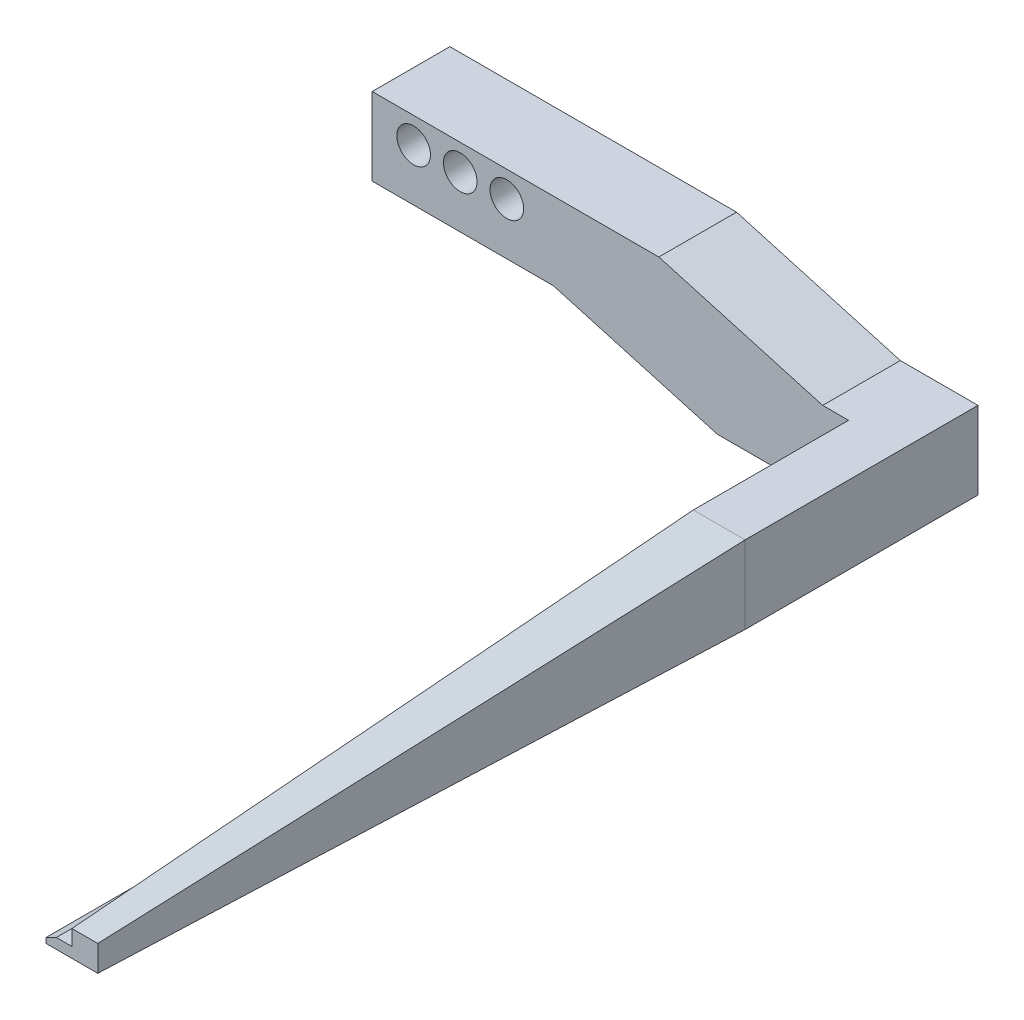
from build123d import *

# Parameters (mm, degrees)
AUFSATZ_LINEAR_AUSTRAGEN1_DEPTH = 15
AUFSATZ_LINEAR_AUSTRAGEN2_DEPTH = 150
SCHNITT_LINEAR_AUSTRAGEN1_REACH = 192.434
SCHNITT_LINEAR_AUSTRAGEN2_REACH = 190.733
SKIZZE4_R                       = 1.7
SKIZZE5_R                       = 3.25
SCHNITT_LINEAR_AUSTRAGEN3_DEPTH = 9
SCHNITT_LINEAR_AUSTRAGEN4_REACH = 201.985


with BuildPart() as part:
    # Skizze1 → Aufsatz-Linear austragen1 (new body)
    with BuildSketch(Plane.XY):
        Polygon((10, 0), (65.364729758, 0), (97, -9), (112, -9), (112, -24), (76.635270242, -24), (45, -15), (10, -15), align=None)
    extrude(amount=AUFSATZ_LINEAR_AUSTRAGEN1_DEPTH)

    # Skizze2 → Aufsatz-Linear austragen2 (add)
    with BuildSketch(Plane.XY.offset(15)):
        Polygon((112, -9), (112, -24), (97, -24), (97, -23), (99, -22), (102, -22), (102, -9), align=None)
    extrude(amount=AUFSATZ_LINEAR_AUSTRAGEN2_DEPTH)

    # Skizze3 → Schnitt-Linear austragen1 (cut, up to next)
    with BuildSketch(Plane.ZY.offset(-102), mode=Mode.PRIVATE) as schnitt_linear_austragen1_sk1:
        Polygon((165, -19), (45, -9), (165, -9), align=None)
    schnitt_linear_austragen1_tool1 = extrude(schnitt_linear_austragen1_sk1.sketch, amount=-SCHNITT_LINEAR_AUSTRAGEN1_REACH, mode=Mode.PRIVATE) & part.part
    add(schnitt_linear_austragen1_tool1.solids().sort_by_distance((102, -12.333333, 125))[0], mode=Mode.SUBTRACT)

    # Skizze4 → Schnitt-Linear austragen2 (cut, up to next)
    with BuildSketch(Plane.XY.offset(15), mode=Mode.PRIVATE) as schnitt_linear_austragen2_sk1:
        with Locations((36, -5)):
            Circle(SKIZZE4_R)
    schnitt_linear_austragen2_tool1 = extrude(schnitt_linear_austragen2_sk1.sketch, amount=-SCHNITT_LINEAR_AUSTRAGEN2_REACH, mode=Mode.PRIVATE) & part.part
    # Skizze4 → Schnitt-Linear austragen2 (cut, up to next)
    with BuildSketch(Plane.XY.offset(15), mode=Mode.PRIVATE) as schnitt_linear_austragen2_sk2:
        with Locations((27, -5)):
            Circle(SKIZZE4_R)
    schnitt_linear_austragen2_tool2 = extrude(schnitt_linear_austragen2_sk2.sketch, amount=-SCHNITT_LINEAR_AUSTRAGEN2_REACH, mode=Mode.PRIVATE) & part.part
    # Skizze4 → Schnitt-Linear austragen2 (cut, up to next)
    with BuildSketch(Plane.XY.offset(15), mode=Mode.PRIVATE) as schnitt_linear_austragen2_sk3:
        with Locations((18, -5)):
            Circle(SKIZZE4_R)
    schnitt_linear_austragen2_tool3 = extrude(schnitt_linear_austragen2_sk3.sketch, amount=-SCHNITT_LINEAR_AUSTRAGEN2_REACH, mode=Mode.PRIVATE) & part.part
    add(schnitt_linear_austragen2_tool1.solids().sort_by_distance((36, -5, 15))[0], mode=Mode.SUBTRACT)
    add(schnitt_linear_austragen2_tool2.solids().sort_by_distance((27, -5, 15))[0], mode=Mode.SUBTRACT)
    add(schnitt_linear_austragen2_tool3.solids().sort_by_distance((18, -5, 15))[0], mode=Mode.SUBTRACT)

    # Skizze5 → Schnitt-Linear austragen3 (cut)
    with BuildSketch(Plane.XY.offset(15)):
        with Locations((18, -5)):
            Circle(SKIZZE5_R)
        with Locations((27, -5)):
            Circle(SKIZZE5_R)
        with Locations((36, -5)):
            Circle(SKIZZE5_R)
    extrude(amount=-SCHNITT_LINEAR_AUSTRAGEN3_DEPTH, mode=Mode.SUBTRACT)

    # Skizze6 → Schnitt-Linear austragen4 (cut, up to next)
    with BuildSketch(Plane(origin=(0, -9, 0), x_dir=(1, 0, 0), z_dir=(0, 1, 0)), mode=Mode.PRIVATE) as schnitt_linear_austragen4_sk1:
        Polygon((112, -165), (107, -165), (112, -45), align=None)
    schnitt_linear_austragen4_tool1 = extrude(schnitt_linear_austragen4_sk1.sketch, amount=-SCHNITT_LINEAR_AUSTRAGEN4_REACH, mode=Mode.PRIVATE) & part.part
    add(schnitt_linear_austragen4_tool1.solids().sort_by_distance((110.333333, -9, 125))[0], mode=Mode.SUBTRACT)


solid = part.part
